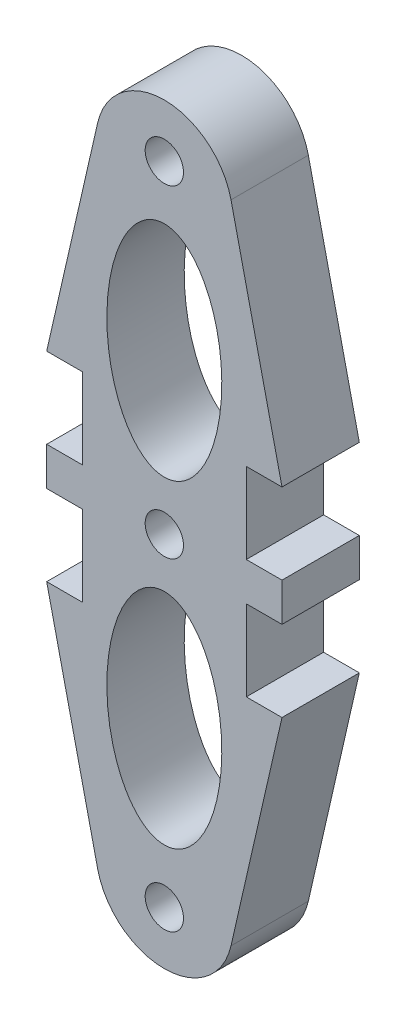
from build123d import *

# Parameters (mm, degrees)
SKETCH1_R           = 1.45
SKETCH1_RX          = 8.302080555
SKETCH1_RY          = 4.346497416
BOSS_EXTRUDE1_DEPTH = 5.85


with BuildPart() as part:
    # Sketch1 → Boss-Extrude1 (new body)
    with BuildSketch(Plane.XY):
        with BuildLine():
            Line((781.459168709, 464.852359197), (778.759168709, 464.852359197))
            Line((778.759168709, 464.852359197), (778.759168709, 461.952359197))
            Line((778.759168709, 461.952359197), (781.459168709, 461.952359197))
            Line((781.459168709, 461.952359197), (781.459168709, 455.852359197))
            Line((781.459168709, 455.852359197), (778.759168709, 455.852359197))
            Line((778.759168709, 455.852359197), (782.615047744, 438.967359197))
            ThreePointArc((782.615047744, 438.967359197), (787.659168709, 434.945268649), (792.703289673, 438.967359197))
            Line((792.703289673, 438.967359197), (796.559168709, 455.852359197))
            Line((796.559168709, 455.852359197), (793.859168709, 455.852359197))
            Line((793.859168709, 455.852359197), (793.859168709, 461.952359197))
            Line((793.859168709, 461.952359197), (796.559168709, 461.952359197))
            Line((796.559168709, 461.952359197), (796.559168709, 464.852359197))
            Line((796.559168709, 464.852359197), (793.859168709, 464.852359197))
            Line((793.859168709, 464.852359197), (793.859168709, 470.952359197))
            Line((793.859168709, 470.952359197), (796.559168709, 470.952359197))
            Line((796.559168709, 470.952359197), (792.703289673, 487.837359197))
            ThreePointArc((792.703289673, 487.837359197), (787.659168709, 491.859449744), (782.615047744, 487.837359197))
            Line((782.615047744, 487.837359197), (778.759168709, 470.952359197))
            Line((778.759168709, 470.952359197), (781.459168709, 470.952359197))
            Line((781.459168709, 470.952359197), (781.459168709, 464.852359197))
        make_face()
        with Locations((787.659168709, 487.837359197)):
            Circle(SKETCH1_R, mode=Mode.SUBTRACT)
        with Locations((787.659168709, 438.967359197)):
            Circle(SKETCH1_R, mode=Mode.SUBTRACT)
        with Locations((787.659168709, 463.402359197)):
            Circle(SKETCH1_R, mode=Mode.SUBTRACT)
        with Locations(Location((787.659168709, 475.448118238), (0, 0, 90))):
            Ellipse(SKETCH1_RX, SKETCH1_RY, mode=Mode.SUBTRACT)
        with Locations(Location((787.659168709, 451.356600156), (0, 0, -90))):
            Ellipse(SKETCH1_RX, SKETCH1_RY, mode=Mode.SUBTRACT)
    extrude(amount=BOSS_EXTRUDE1_DEPTH)


solid = part.part
